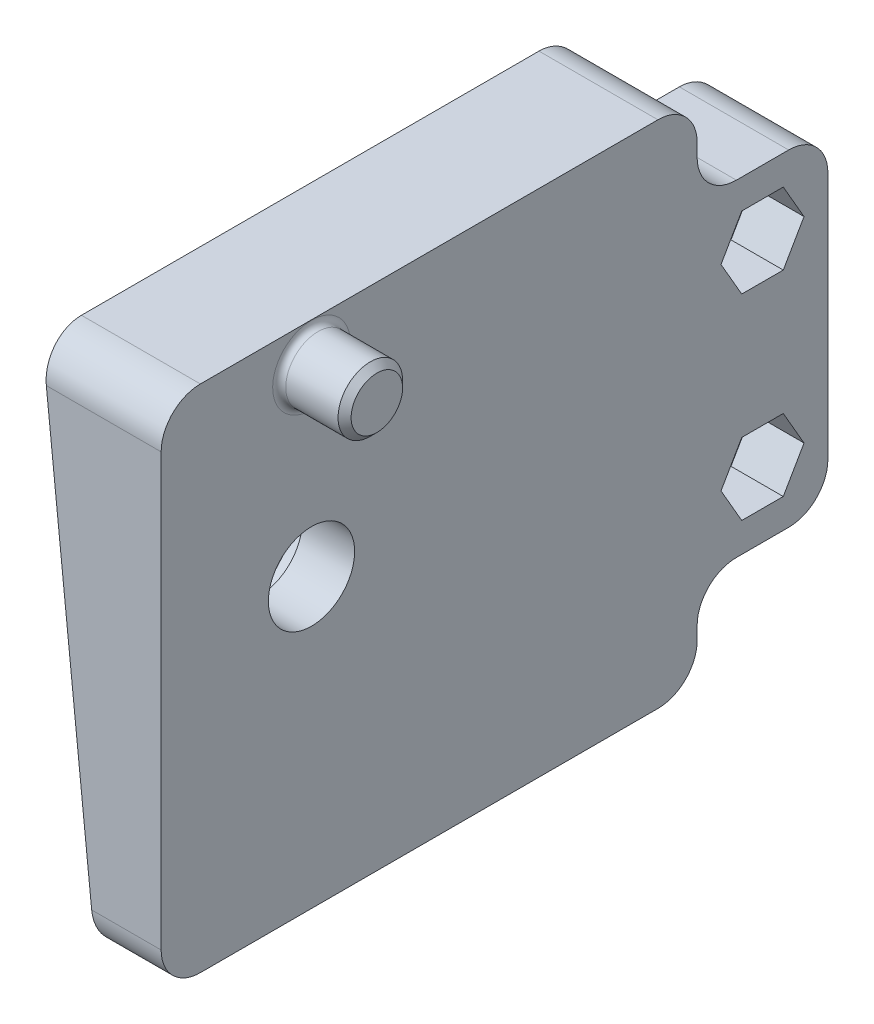
from build123d import *

# Parameters (mm, degrees)
EXTRUDE_1_DEPTH     = 41
CUT_EXTRUDE_1_REACH = 59.313
SKETCH_2_R          = 3.3
CUT_EXTRUDE_2_REACH = 58.815
SKETCH_3_R          = 6.4
SKETCH_4_R          = 2.47
EXTRUDE_2_DEPTH     = 5
CHAMFER_1_SIZE      = 0.5
FILLET_1_R          = 0.5
EXTRUDE_3_DEPTH     = 10
CUT_EXTRUDE_3_DEPTH = 4
CUT_EXTRUDE_4_REACH = 59.297
SKETCH_7_R          = 1.65
FILLET_2_R          = 3


with BuildPart() as part:
    # 草图1 → 凸台-拉伸1 (new body)
    with BuildSketch(Plane.XY):
        Polygon((0, 0), (5, 0), (5, 39), (-4.099065175, 39), align=None)
    extrude(amount=EXTRUDE_1_DEPTH)

    # 切除-拉伸1: up to this plane
    cut_extrude_1_end = Plane(origin=(0, 0, 41), z_dir=(0.9945218953682742, 0.10452846326764682, 0))
    # 草图2 → 切除-拉伸1 (cut, up to the surface)
    with BuildSketch(Plane(origin=(5, 0, 0), x_dir=(0, 0, -1), z_dir=(1, 0, 0)), mode=Mode.PRIVATE) as cut_extrude_1_sk1:
        with Locations(Location((-29.5, 22, 0), (0, 0, 90))):
            Circle(SKETCH_2_R)
    cut_extrude_1_tool1 = split(extrude(cut_extrude_1_sk1.sketch, amount=-CUT_EXTRUDE_1_REACH, mode=Mode.PRIVATE), bisect_by=cut_extrude_1_end, keep=Keep.BOTH, mode=Mode.PRIVATE)
    add(cut_extrude_1_tool1.solids().sort_by_distance((5, 22, 29.5))[0], mode=Mode.SUBTRACT)

    # 切除-拉伸2: up to this plane
    cut_extrude_2_end = Plane(origin=(0, 0, 41), z_dir=(0.9945218953682742, 0.10452846326764682, 0))
    # 草图3 → 切除-拉伸2 (cut, up to the surface)
    with BuildSketch(Plane.ZY.offset(-1), mode=Mode.PRIVATE) as cut_extrude_2_sk1:
        with Locations(Location((29.5, 22, 0), (0, 0, 270))):
            Circle(SKETCH_3_R)
    cut_extrude_2_tool1 = split(extrude(cut_extrude_2_sk1.sketch, amount=CUT_EXTRUDE_2_REACH, mode=Mode.PRIVATE), bisect_by=cut_extrude_2_end, keep=Keep.BOTH, mode=Mode.PRIVATE)
    add(cut_extrude_2_tool1.solids().sort_by_distance((1, 22, 29.5))[0], mode=Mode.SUBTRACT)

    # 草图4 → 凸台-拉伸2 (add)
    with BuildSketch(Plane(origin=(5, 0, 0), x_dir=(0, 0, -1), z_dir=(1, 0, 0))):
        with Locations(Location((-29.5, 36, 0), (0, 0, 270))):
            Circle(SKETCH_4_R)
    extrude(amount=EXTRUDE_2_DEPTH)

    # 倒角1
    chamfer_1_edges = [part.edges().sort_by_distance(p)[0] for p in [
        (10, 38.47, 29.5),
    ]]
    chamfer(chamfer_1_edges, length=CHAMFER_1_SIZE)

    # 圆角1
    fillet_1_edges = [part.edges().sort_by_distance(p)[0] for p in [
        (5, 38.47, 29.5),
    ]]
    fillet(fillet_1_edges, radius=FILLET_1_R)

    # 草图5 → 凸台-拉伸3 (add)
    with BuildSketch(Plane(origin=(0, 0, 0), x_dir=(-1, 0, 0), z_dir=(0, 0, -1))):
        Polygon((-5, 32), (3.363335529, 32), (0.735729647, 7), (-5, 7), align=None)
    extrude(amount=EXTRUDE_3_DEPTH)

    # 草图6 → 切除-拉伸3 (cut)
    with BuildSketch(Plane(origin=(5, 0, 0), x_dir=(0, 0, -1), z_dir=(1, 0, 0))):
        Polygon((8.175426481, 27), (6.58771324, 29.75), (3.41228676, 29.75), (1.824573519, 27), (3.41228676, 24.25), (6.58771324, 24.25), align=None)
        Polygon((8.175426481, 12), (6.58771324, 14.75), (3.41228676, 14.75), (1.824573519, 12), (3.41228676, 9.25), (6.58771324, 9.25), align=None)
    extrude(amount=-CUT_EXTRUDE_3_DEPTH, mode=Mode.SUBTRACT)

    # 切除-拉伸4: up to this plane
    cut_extrude_4_end = Plane(origin=(0, 0, 41), z_dir=(0.9945218953682742, 0.10452846326764682, 0))
    # 草图7 → 切除-拉伸4 (cut, up to the surface)
    with BuildSketch(Plane(origin=(1, 0, 0), x_dir=(0, 0, -1), z_dir=(1, 0, 0)), mode=Mode.PRIVATE) as cut_extrude_4_sk1:
        with Locations((5, 27)):
            Circle(SKETCH_7_R)
    cut_extrude_4_tool1 = split(extrude(cut_extrude_4_sk1.sketch, amount=-CUT_EXTRUDE_4_REACH, mode=Mode.PRIVATE), bisect_by=cut_extrude_4_end, keep=Keep.BOTH, mode=Mode.PRIVATE)
    add(cut_extrude_4_tool1.solids().sort_by_distance((1, 27, -5))[0], mode=Mode.SUBTRACT)
    # 草图7 → 切除-拉伸4 (cut, up to the surface)
    with BuildSketch(Plane(origin=(1, 0, 0), x_dir=(0, 0, -1), z_dir=(1, 0, 0)), mode=Mode.PRIVATE) as cut_extrude_4_sk2:
        with Locations((5, 12)):
            Circle(SKETCH_7_R)
    cut_extrude_4_tool2 = split(extrude(cut_extrude_4_sk2.sketch, amount=-CUT_EXTRUDE_4_REACH, mode=Mode.PRIVATE), bisect_by=cut_extrude_4_end, keep=Keep.BOTH, mode=Mode.PRIVATE)
    add(cut_extrude_4_tool2.solids().sort_by_distance((1, 12, -5))[0], mode=Mode.SUBTRACT)

    # 圆角2
    fillet_2_edges = [part.edges().sort_by_distance(p)[0] for p in [
        (0.450467412, 39, 41),
        (2.132135177, 7, 0),
        (0.818332236, 32, 0),
        (2.132135177, 7, -10),
        (0.818332236, 32, -10),
        (0.450467412, 39, 0),
        (2.5, 0, 0),
        (2.5, 0, 41),
    ]]
    fillet(fillet_2_edges, radius=FILLET_2_R)


solid = part.part
